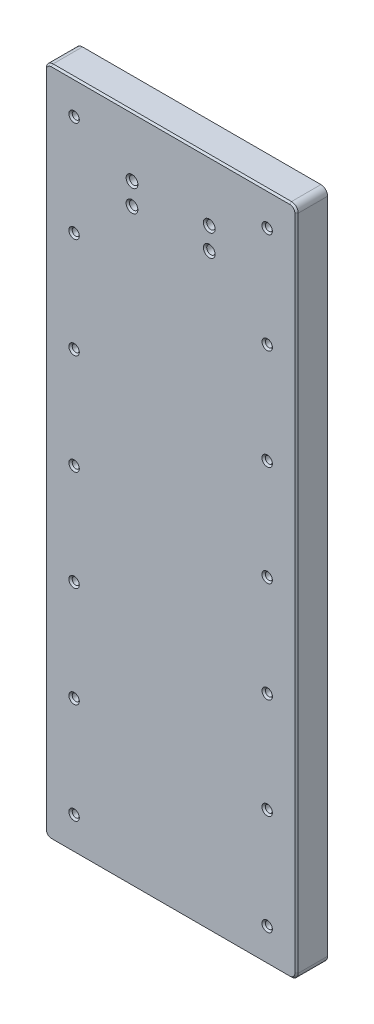
from build123d import *

# Parameters (mm, degrees)
SKETCH1_W                 = 150
SKETCH1_H                 = 400
BOSS_EXTRUDE1_DEPTH       = 18.5
CUT_EXTRUDE1_DEPTH        = 11.5
FILLET1_R                 = 4
CUT_EXTRUDE3_DEPTH        = 8
M6X1_0_TAPPED_HOLE1_D     = 5
M6X1_0_TAPPED_HOLE1_DEPTH = 13.497848452
M6X1_0_TAPPED_HOLE1_TIP   = 1.502151548
CUT_EXTRUDE4_DEPTH        = 11.5
FILLET3_R                 = 4
M5X0_8_TAPPED_HOLE1_D     = 4.2
FILLET5_R                 = 4
CHAMFER2_SIZE             = 1
FILLET6_R                 = 4
CHAMFER3_SIZE             = 3


with BuildPart() as part:
    # Sketch1 → Boss-Extrude1 (new body)
    with BuildSketch(Plane.XY):
        with Locations((61, 100)):
            Rectangle(SKETCH1_W, SKETCH1_H)
    extrude(amount=BOSS_EXTRUDE1_DEPTH)

    # Sketch2 → Cut-Extrude1 (cut)
    with BuildSketch(Plane.XY):
        Polygon((61, 272), (28, 272), (28, 270), (28, 240), (94, 240), (94, 270), (94, 272), align=None)
    extrude(amount=CUT_EXTRUDE1_DEPTH, mode=Mode.SUBTRACT)

    # Fillet1
    fillet1_edges = [part.edges().sort_by_distance(p)[0] for p in [
        (28, 240, 5.75),
        (94, 240, 5.75),
    ]]
    fillet(fillet1_edges, radius=FILLET1_R)

    # Sketch6 → Cut-Extrude3 (cut)
    with BuildSketch(Plane(origin=(0, 0, 0), x_dir=(-1, 0, 0), z_dir=(0, 0, -1))):
        Polygon((-46, 240), (-76, 240), (-79, 240), (-80, 240), (-80, 50), (-80, 44), (-80, -9), (-80, -25), (-42, -25), (-42, -9), (-42, 44), (-42, 50), (-42, 240), (-43, 240), align=None)
    extrude(amount=-CUT_EXTRUDE3_DEPTH, mode=Mode.SUBTRACT)

    # M6x1.0 Tapped Hole1
    with Locations(Plane(origin=(0, 0, 11.5), x_dir=(-1, 0, 0), z_dir=(0, 0, -1))):
        with Locations((-84, 264), (-38, 264), (-38, 251), (-84, 251)):
            Hole(M6X1_0_TAPPED_HOLE1_D / 2, depth=M6X1_0_TAPPED_HOLE1_DEPTH)
            with Locations((0, 0, -(M6X1_0_TAPPED_HOLE1_DEPTH + M6X1_0_TAPPED_HOLE1_TIP / 2))):  # 118° drill point
                Cone(0, M6X1_0_TAPPED_HOLE1_D / 2, M6X1_0_TAPPED_HOLE1_TIP, mode=Mode.SUBTRACT)

    # Sketch11 → Cut-Extrude4 (cut)
    with BuildSketch(Plane(origin=(0, 0, 0), x_dir=(-1, 0, 0), z_dir=(0, 0, -1))):
        with BuildLine():
            Line((-61, 262), (-79, 262))
            Line((-79, 262), (-79, 273))
            ThreePointArc((-79, 273), (-77.828427125, 275.828427125), (-75, 277))
            Line((-75, 277), (-47, 277))
            ThreePointArc((-47, 277), (-44.171572875, 275.828427125), (-43, 273))
            Line((-43, 273), (-43, 262))
            Line((-43, 262), (-61, 262))
        make_face()
    extrude(amount=-CUT_EXTRUDE4_DEPTH, mode=Mode.SUBTRACT)

    # Fillet3
    fillet3_edges = [part.edges().sort_by_distance(p)[0] for p in [
        (28, 272, 5.75),
        (94, 272, 5.75),
        (43, 272, 5.75),
        (79, 272, 5.75),
    ]]
    fillet(fillet3_edges, radius=FILLET3_R)

    # M5x0.8 Tapped Hole1 (through all)
    with Locations(Plane(origin=(0, 0, 0), x_dir=(-1, 0, 0), z_dir=(0, 0, -1))):
        with Locations((-118.5, 280), (-3.5, 280), (-118.5, 220), (-3.5, 220), (-3.5, 160), (-118.5, 160), (-118.5, 100), (-3.5, 100), (-3.5, 40), (-118.5, 40), (-3.5, -20), (-118.5, -20), (-118.5, -80), (-3.5, -80)):
            Hole(M5X0_8_TAPPED_HOLE1_D / 2)

    # Fillet5
    fillet5_edges = [part.edges().sort_by_distance(p)[0] for p in [
        (-14, 300, 9.25),
        (136, 300, 9.25),
        (136, -100, 9.25),
        (-14, -100, 9.25),
    ]]
    fillet(fillet5_edges, radius=FILLET5_R)

    # Chamfer2
    chamfer2_edges = [part.edges().sort_by_distance(p)[0] for p in [
        (1.4, -80, 18.5),
        (116.4, -80, 18.5),
        (116.4, -20, 18.5),
        (1.4, -20, 18.5),
        (116.4, 40, 18.5),
        (1.4, 40, 18.5),
        (1.4, 100, 18.5),
        (116.4, 100, 18.5),
        (116.4, 160, 18.5),
        (1.4, 160, 18.5),
        (1.4, 220, 18.5),
        (116.4, 220, 18.5),
        (1.4, 280, 18.5),
        (116.4, 280, 18.5),
        (61, -100, 18.5),
        (-14, 100, 18.5),
        (136, 100, 18.5),
        (61, 300, 18.5),
        (-12.828427125, 298.828427125, 18.5),
        (134.828427125, 298.828427125, 18.5),
        (134.828427125, -98.828427125, 18.5),
        (-12.828427125, -98.828427125, 18.5),
        (81.5, 251, 18.5),
        (35.5, 251, 18.5),
        (35.5, 264, 18.5),
        (81.5, 264, 18.5),
    ]]
    chamfer(chamfer2_edges, length=CHAMFER2_SIZE)

    # Fillet6
    fillet6_edges = [part.edges().sort_by_distance(p)[0] for p in [
        (42, 240, 4),
        (42, -25, 4),
        (80, -25, 4),
        (80, 240, 4),
    ]]
    fillet(fillet6_edges, radius=FILLET6_R)

    # Chamfer3
    chamfer3_edges = [part.edges().sort_by_distance(p)[0] for p in [
        (61, 277, 0),
        (77.236067977, 276.31662479, 0),
        (44.763932023, 276.31662479, 0),
        (86.208099244, 272, 0),
        (35.791900756, 272, 0),
        (28, 256, 0),
        (80.18013051, 272.68337521, 0),
        (41.81986949, 272.68337521, 0),
        (29.171572875, 270.828427125, 0),
        (92.828427125, 270.828427125, 0),
        (35, 240, 0),
        (94, 256, 0),
        (92.828427125, 241.171572875, 0),
        (29.171572875, 241.171572875, 0),
        (87, 240, 0),
        (42, 107.5, 0),
        (61, -25, 0),
        (80, 107.5, 0),
        (81.171572875, 238.828427125, 0),
        (40.828427125, 238.828427125, 0),
        (43.171572875, -23.828427125, 0),
        (78.828427125, -23.828427125, 0),
    ]]
    chamfer(chamfer3_edges, length=CHAMFER3_SIZE)


solid = part.part
